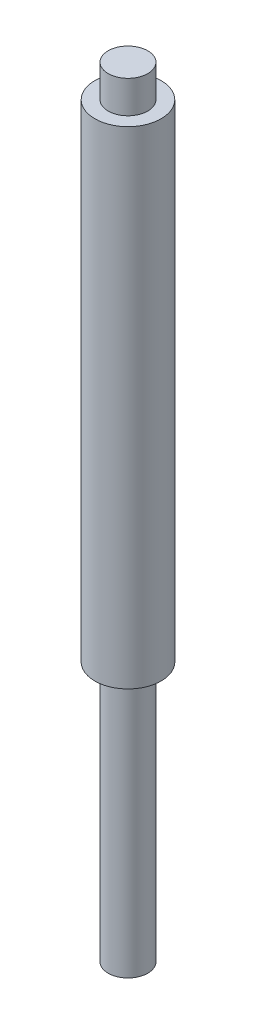
from build123d import *

# Parameters (mm, degrees)
SKETCH1_R           = 0.61
BOSS_EXTRUDE1_DEPTH = 8
SKETCH2_R           = 1.02
BOSS_EXTRUDE2_DEPTH = 15
BOSS_EXTRUDE3_START = 1
SKETCH4_R           = 0.61
BOSS_EXTRUDE3_DEPTH = 1


with BuildPart() as part:
    # Sketch1 → Boss-Extrude1 (new body)
    with BuildSketch(Plane(origin=(0, 0, 0), x_dir=(1, 0, 0), z_dir=(0, 1, 0))):
        with Locations(Location((0, 0, 0), (0, 0, 270))):
            Circle(SKETCH1_R)
    extrude(amount=-BOSS_EXTRUDE1_DEPTH)

    # Sketch2 → Boss-Extrude2 (add)
    with BuildSketch(Plane(origin=(0, 0, 0), x_dir=(1, 0, 0), z_dir=(0, 1, 0))):
        with Locations(Location((0, 0, 0), (0, 0, 270))):
            Circle(SKETCH2_R)
    extrude(amount=BOSS_EXTRUDE2_DEPTH)

    # Sketch4 → Boss-Extrude3 (add)
    with BuildSketch(Plane(origin=(0, 15, 0), x_dir=(1, 0, 0), z_dir=(0, 1, 0)).offset(BOSS_EXTRUDE3_START)):
        with Locations(Location((0, 0, 0), (0, 0, 270))):
            Circle(SKETCH4_R)
    extrude(amount=-BOSS_EXTRUDE3_DEPTH)


solid = part.part
